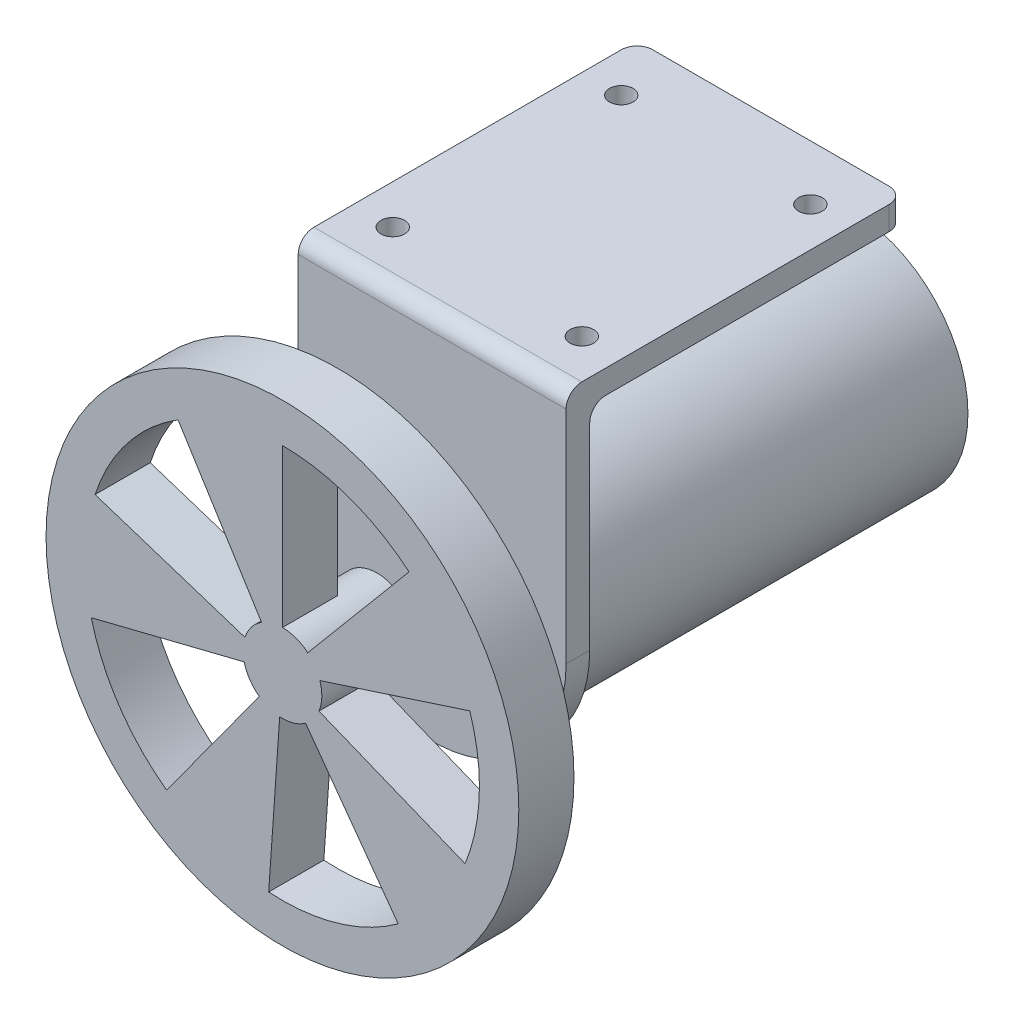
from build123d import *

# Parameters (mm, degrees)
SKETCH1_R           = 15
BOSS_EXTRUDE1_DEPTH = 50
SKETCH2_R           = 1.5
BOSS_EXTRUDE2_DEPTH = 15
BOSS_EXTRUDE4_DEPTH = 3
SKETCH5_W           = 34
SKETCH5_H           = 3
BOSS_EXTRUDE5_DEPTH = 40
FILLET2_R           = 2
SKETCH6_R           = 30
BOSS_EXTRUDE6_DEPTH = 7
CUT_EXTRUDE1_DEPTH  = 7
SKETCH8_R           = 5
BOSS_EXTRUDE7_DEPTH = 5
SKETCH9_R           = 1.5
CUT_EXTRUDE2_DEPTH  = 5


with BuildPart() as part:
    # Sketch1 → Boss-Extrude1 (new body)
    with BuildSketch(Plane.XY):
        Circle(SKETCH1_R)
    extrude(amount=BOSS_EXTRUDE1_DEPTH)

    # Sketch2 → Boss-Extrude2 (add)
    with BuildSketch(Plane.XY.offset(50)):
        Circle(SKETCH2_R)
    extrude(amount=BOSS_EXTRUDE2_DEPTH)

    # Sketch4 → Boss-Extrude4 (add)
    with BuildSketch(Plane.XY.offset(50)):
        with BuildLine():
            Line((-17, 0), (-17, 30))
            Line((-17, 30), (17, 30))
            Line((17, 30), (17, 0))
            ThreePointArc((17, 0), (0, -17), (-17, 0))
        make_face()
    extrude(amount=BOSS_EXTRUDE4_DEPTH)

    # Sketch5 → Boss-Extrude5 (add)
    with BuildSketch(Plane(origin=(0, 0, 50), x_dir=(-1, 0, 0), z_dir=(0, 0, -1))):
        with Locations((0, 28.5)):
            Rectangle(SKETCH5_W, SKETCH5_H)
    extrude(amount=BOSS_EXTRUDE5_DEPTH)

    # Fillet2
    fillet2_edges = [part.edges().sort_by_distance(p)[0] for p in [
        (0, 30, 53),
        (0, 27, 50),
        (17, 28.5, 10),
        (-17, 28.5, 10),
    ]]
    fillet(fillet2_edges, radius=FILLET2_R)

    # Sketch6 → Boss-Extrude6 (add)
    with BuildSketch(Plane.XY.offset(65)):
        with Locations(Location((0, 0, 0), (0, 0, 180))):
            Circle(SKETCH6_R)
    extrude(amount=BOSS_EXTRUDE6_DEPTH)

    # Sketch7 → Cut-Extrude1 (cut)
    with BuildSketch(Plane.XY.offset(72)):
        with BuildLine():
            Line((0, 25), (0, 5))
            ThreePointArc((0, 5), (1.710100717, 4.698463104), (3.213938048, 3.830222216))
            Line((3.213938048, 3.830222216), (16.069690242, 19.151111078))
            ThreePointArc((16.069690242, 19.151111078), (8.550503583, 23.49231552), (0, 25))
        make_face()
        with BuildLine():
            Line((23.776412907, 7.725424859), (4.755282581, 1.545084972))
            ThreePointArc((4.755282581, 1.545084972), (4.996954135, -0.174497484), (4.635919273, -1.873032967))
            Line((4.635919273, -1.873032967), (23.179596364, -9.365164835))
            ThreePointArc((23.179596364, -9.365164835), (24.984770675, -0.872487418), (23.776412907, 7.725424859))
        make_face()
        with BuildLine():
            Line((14.694631307, -20.225424859), (2.938926261, -4.045084972))
            ThreePointArc((2.938926261, -4.045084972), (1.378186779, -4.80630848), (-0.348782369, -4.987820251))
            Line((-0.348782369, -4.987820251), (-1.743911844, -24.939101256))
            ThreePointArc((-1.743911844, -24.939101256), (6.890933895, -24.031542398), (14.694631307, -20.225424859))
        make_face()
        with BuildLine():
            Line((-14.694631307, -20.225424859), (-2.938926261, -4.045084972))
            ThreePointArc((-2.938926261, -4.045084972), (-4.145187863, -2.795964517), (-4.851478631, -1.209609478))
            Line((-4.851478631, -1.209609478), (-24.257393157, -6.04804739))
            ThreePointArc((-24.257393157, -6.04804739), (-20.725939314, -13.979822587), (-14.694631307, -20.225424859))
        make_face()
        with BuildLine():
            Line((-23.776412907, 7.725424859), (-4.755282581, 1.545084972))
            ThreePointArc((-4.755282581, 1.545084972), (-3.940053768, 3.078307377), (-2.649596321, 4.240240481))
            Line((-2.649596321, 4.240240481), (-13.247981606, 21.201202404))
            ThreePointArc((-13.247981606, 21.201202404), (-19.70026884, 15.391536883), (-23.776412907, 7.725424859))
        make_face()
    extrude(amount=-CUT_EXTRUDE1_DEPTH, mode=Mode.SUBTRACT)

    # Sketch8 → Boss-Extrude7 (add)
    with BuildSketch(Plane(origin=(0, 0, 65), x_dir=(-1, 0, 0), z_dir=(0, 0, -1))):
        with Locations(Location((0, 0, 0), (0, 0, 162))):
            Circle(SKETCH8_R)
    extrude(amount=BOSS_EXTRUDE7_DEPTH)

    # Sketch9 → Cut-Extrude2 (cut)
    with BuildSketch(Plane(origin=(0, 30, 0), x_dir=(1, 0, 0), z_dir=(0, 1, 0))):
        with Locations(Location((-12, -46, 0), (0, 0, 270))):
            Circle(SKETCH9_R)
        with Locations(Location((-12, -17, 0), (0, 0, 270))):
            Circle(SKETCH9_R)
        with Locations(Location((12, -46, 0), (0, 0, 270))):
            Circle(SKETCH9_R)
        with Locations(Location((12, -17, 0), (0, 0, 270))):
            Circle(SKETCH9_R)
    extrude(amount=-CUT_EXTRUDE2_DEPTH, mode=Mode.SUBTRACT)


solid = part.part
